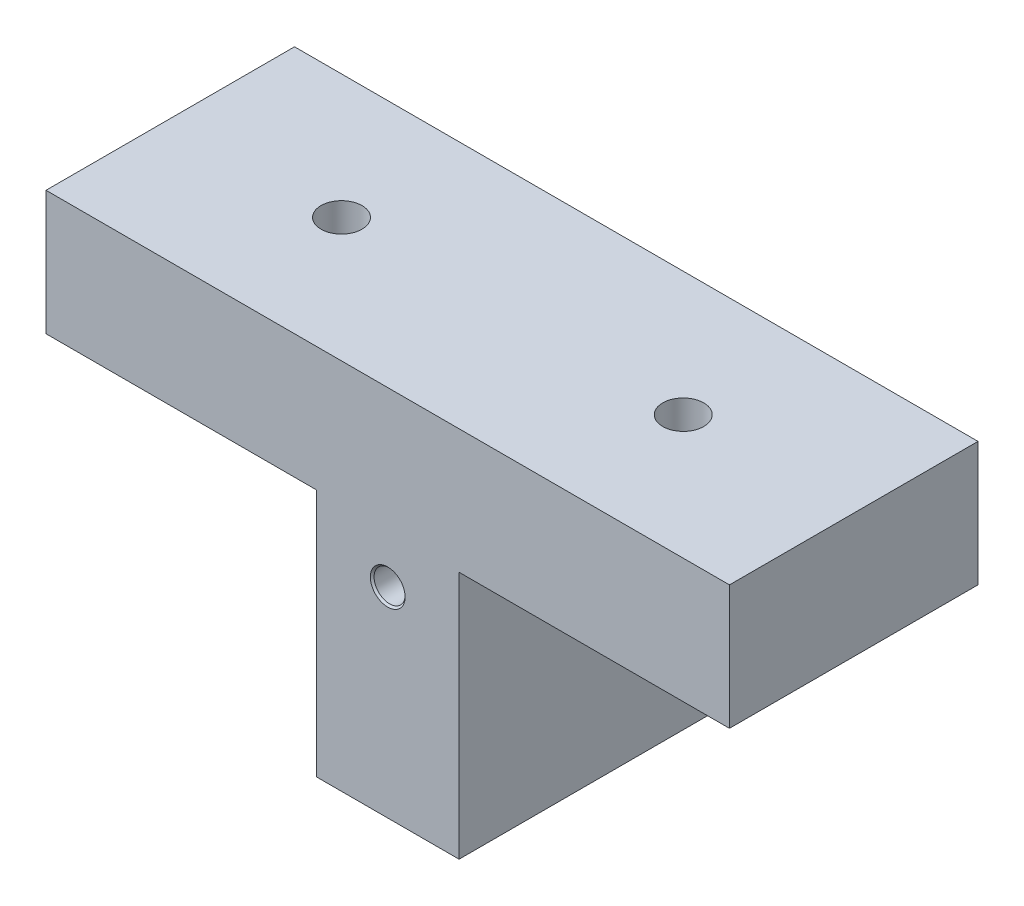
from build123d import *

# Parameters (mm, degrees)
BOSS_EXTRUDE1_DEPTH               = 20
TAP_DRILL_FOR_M3_TAP1_D           = 2.5
TAP_DRILL_FOR_M3_TAP1_CSINK_D     = 2.8
TAP_DRILL_FOR_M3_TAP1_CSINK_ANGLE = 90
TAP_DRILL_FOR_M4_TAP1_D           = 3.3
TAP_DRILL_FOR_M4_TAP1_CSINK_D     = 3.35
TAP_DRILL_FOR_M4_TAP1_CSINK_ANGLE = 90


with BuildPart() as part:
    # Sketch1 → Boss-Extrude1 (new body)
    with BuildSketch(Plane.XY):
        Polygon((5.74072013, -5), (27.5, -5), (27.5, 5), (-27.5, 5), (-27.5, -5), (-5.74072013, -5), (-5.74072013, -25), (5.74072013, -25), align=None)
    extrude(amount=BOSS_EXTRUDE1_DEPTH)

    # Tap Drill for M3 Tap1 (through all)
    with Locations(Plane(origin=(0, -8.9, 20), x_dir=(1, 0, 0), z_dir=(0, 0, 1))):
        with Locations((0, 0)):
            CounterSinkHole(TAP_DRILL_FOR_M3_TAP1_D / 2, TAP_DRILL_FOR_M3_TAP1_CSINK_D / 2, counter_sink_angle=TAP_DRILL_FOR_M3_TAP1_CSINK_ANGLE)

    # Tap Drill for M4 Tap1 (through all)
    with Locations(Plane(origin=(13.78, -5, 10), x_dir=(0, 0, -1), z_dir=(0, -1, 0))):
        with Locations((0, 0), (0, -27.5)):
            CounterSinkHole(TAP_DRILL_FOR_M4_TAP1_D / 2, TAP_DRILL_FOR_M4_TAP1_CSINK_D / 2, counter_sink_angle=TAP_DRILL_FOR_M4_TAP1_CSINK_ANGLE)


solid = part.part
